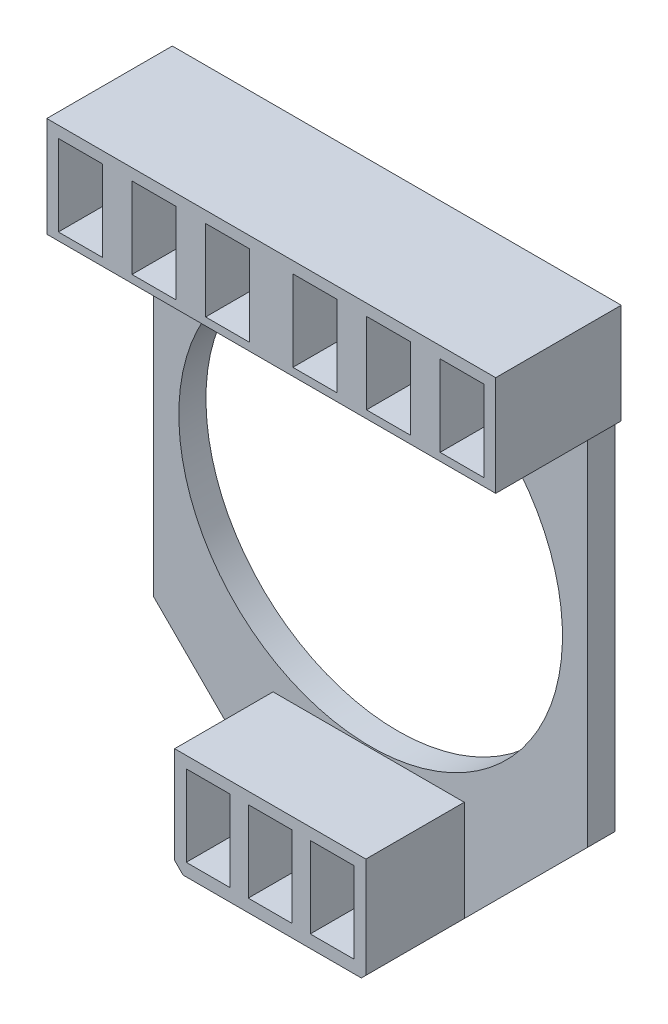
from build123d import *

# Parameters (mm, degrees)
SKETCH2_R           = 49.5
SKETCH2_W           = 5.44
SKETCH2_H           = 15
BOSS_EXTRUDE1_DEPTH = 7
BOSS_EXTRUDE2_START = 7
SKETCH2_3_W         = 115.8532
SKETCH2_3_H         = 25.8601
SKETCH2_3_W_2       = 11.343
SKETCH2_3_H_2       = 20.901
BOSS_EXTRUDE2_DEPTH = 25.4


with BuildPart() as part:
    # Sketch2 → Boss-Extrude1 (new body)
    with BuildSketch(Plane.XY):
        Polygon((-58.1817, 74.5), (-58.1817, 48.6399), (-56, 48.6399), (-56, -44), (-23, -77), (23, -77), (56, -44), (56, 48.6399), (57.6715, 48.6399), (57.6715, 74.5), align=None)
        Circle(SKETCH2_R, mode=Mode.SUBTRACT)
        with Locations((-16.5102, -63.2904)):
            Rectangle(SKETCH2_W, SKETCH2_H, mode=Mode.SUBTRACT)
        with Locations((-30.5102, 61.0904)):
            Rectangle(SKETCH2_W, SKETCH2_H, mode=Mode.SUBTRACT)
        with Locations((-49.5102, 61.0904)):
            Rectangle(SKETCH2_W, SKETCH2_H, mode=Mode.SUBTRACT)
        with Locations((-11.5102, 61.0904)):
            Rectangle(SKETCH2_W, SKETCH2_H, mode=Mode.SUBTRACT)
        with Locations((49, 61.0904)):
            Rectangle(SKETCH2_W, SKETCH2_H, mode=Mode.SUBTRACT)
        with Locations((30, 61.0904)):
            Rectangle(SKETCH2_W, SKETCH2_H, mode=Mode.SUBTRACT)
        with Locations((11, 61.0904)):
            Rectangle(SKETCH2_W, SKETCH2_H, mode=Mode.SUBTRACT)
        with Locations((-0.5102, -63.2904)):
            Rectangle(SKETCH2_W, SKETCH2_H, mode=Mode.SUBTRACT)
        with Locations((15.4898, -63.2904)):
            Rectangle(SKETCH2_W, SKETCH2_H, mode=Mode.SUBTRACT)
    extrude(amount=BOSS_EXTRUDE1_DEPTH)

    # Sketch2<3> → Boss-Extrude2 (add)
    # profile 1 of 2: a face of its own
    with BuildSketch(Plane.XY.offset(BOSS_EXTRUDE2_START)):
        with Locations((-0.2551, 61.56995)):
            Rectangle(SKETCH2_3_W, SKETCH2_3_H)
        with Locations((49, 61.0904)):
            Rectangle(SKETCH2_3_W_2, SKETCH2_3_H_2, mode=Mode.SUBTRACT)
        with Locations((-49.5102, 61.0904)):
            Rectangle(SKETCH2_3_W_2, SKETCH2_3_H_2, mode=Mode.SUBTRACT)
        with Locations((-30.5102, 61.0904)):
            Rectangle(SKETCH2_3_W_2, SKETCH2_3_H_2, mode=Mode.SUBTRACT)
        with Locations((-11.5102, 61.0904)):
            Rectangle(SKETCH2_3_W_2, SKETCH2_3_H_2, mode=Mode.SUBTRACT)
        with Locations((11, 61.0904)):
            Rectangle(SKETCH2_3_W_2, SKETCH2_3_H_2, mode=Mode.SUBTRACT)
        with Locations((30, 61.0904)):
            Rectangle(SKETCH2_3_W_2, SKETCH2_3_H_2, mode=Mode.SUBTRACT)
    # profile 2 of 2: a face of its own
    with BuildSketch(Plane.XY.offset(BOSS_EXTRUDE2_START)):
        Polygon((-25.1817, -49.8399), (-25.1817, -74.8183), (-23, -77), (23, -77), (24.1613, -75.8387), (24.1613, -49.8399), align=None)
        with Locations((-16.5102, -63.2904)):
            Rectangle(SKETCH2_3_W_2, SKETCH2_3_H_2, mode=Mode.SUBTRACT)
        with Locations((-0.5102, -63.2904)):
            Rectangle(SKETCH2_3_W_2, SKETCH2_3_H_2, mode=Mode.SUBTRACT)
        with Locations((15.4898, -63.2904)):
            Rectangle(SKETCH2_3_W_2, SKETCH2_3_H_2, mode=Mode.SUBTRACT)
    extrude(amount=BOSS_EXTRUDE2_DEPTH)


solid = part.part
